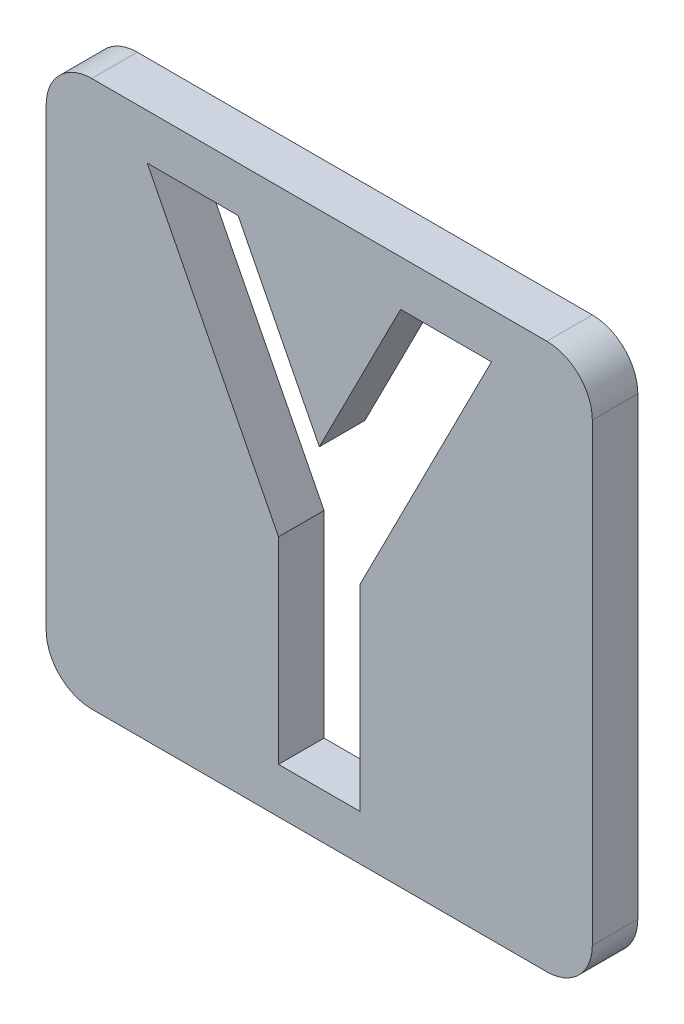
from build123d import *

# Parameters (mm, degrees)
BOSS_EXTRUDE1_DEPTH = 10
CUT_EXTRUDE38_DEPTH = 10


with BuildPart() as part:
    # Sketch1 → Boss-Extrude1 (new body)
    with BuildSketch(Plane.XY):
        with BuildLine():
            Line((-50, 60), (50, 60))
            ThreePointArc((50, 60), (57.071067812, 57.071067812), (60, 50))
            Line((60, 50), (60, -50))
            ThreePointArc((60, -50), (57.071067812, -57.071067812), (50, -60))
            Line((50, -60), (-50, -60))
            ThreePointArc((-50, -60), (-57.071067812, -57.071067812), (-60, -50))
            Line((-60, -50), (-60, 50))
            ThreePointArc((-60, 50), (-57.071067812, 57.071067812), (-50, 60))
        make_face()
    extrude(amount=BOSS_EXTRUDE1_DEPTH)

    # Sketch2 → Cut-Extrude38 (cut)
    with BuildSketch(Plane.XY.offset(10)):
        Polygon((-37.794871795, 50), (-17.822916667, 50), (0.025641026, 14.923878205), (17.874198718, 50), (37.846153846, 50), (9, -6.690705128), (9, -50), (-8.948717949, -50), (-8.948717949, -6.690705128), align=None)
    extrude(amount=-CUT_EXTRUDE38_DEPTH, mode=Mode.SUBTRACT)


solid = part.part
